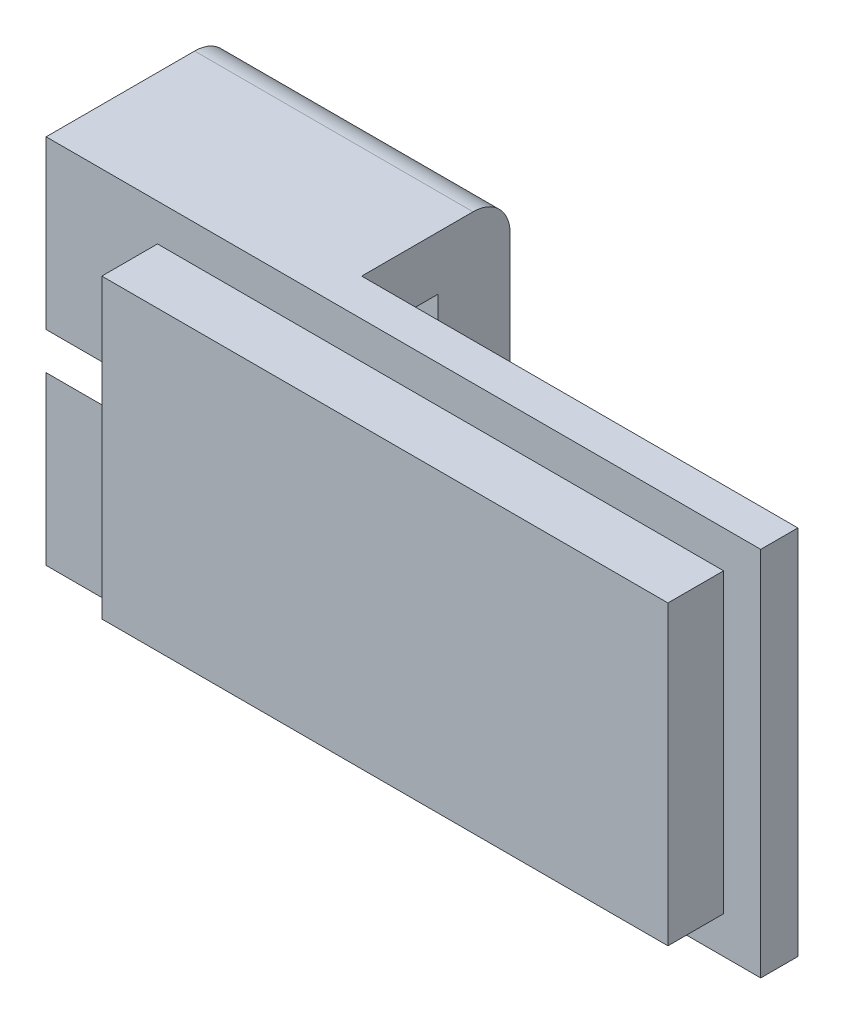
from build123d import *

# Parameters (mm, degrees)
SKETCH1_W           = 20
SKETCH1_H           = 10
BOSS_EXTRUDE1_DEPTH = 38.5
SKETCH5_W           = 16
SKETCH5_H           = 30.5
BOSS_EXTRUDE2_DEPTH = 8
SKETCH2_R           = 5.1
CUT_EXTRUDE3_DEPTH  = 10
FILLET1_R           = 2
SKETCH6_W           = 23.5
SKETCH6_H           = 20
CUT_EXTRUDE4_DEPTH  = 8
SKETCH7_W           = 2.2
SKETCH7_H           = 2.2
CUT_EXTRUDE5_DEPTH  = 3


with BuildPart() as part:
    # Sketch1 → Boss-Extrude1 (new body)
    with BuildSketch(Plane.YZ):
        Rectangle(SKETCH1_W, SKETCH1_H)
    extrude(amount=BOSS_EXTRUDE1_DEPTH)

    # Sketch5 → Boss-Extrude2 (add)
    with BuildSketch(Plane(origin=(0, 0, 0), x_dir=(0, 1, 0), z_dir=(0, 0, 1))):
        with Locations((0, -21.25)):
            Rectangle(SKETCH5_W, SKETCH5_H)
    extrude(amount=BOSS_EXTRUDE2_DEPTH)

    # Sketch2 → Cut-Extrude3 (cut)
    with BuildSketch(Plane.YZ):
        Circle(SKETCH2_R)
    extrude(amount=CUT_EXTRUDE3_DEPTH, mode=Mode.SUBTRACT)

    # Fillet1
    fillet1_edges = [part.edges().sort_by_distance(p)[0] for p in [
        (19.25, 10, -5),
        (19.25, -10, -5),
    ]]
    fillet(fillet1_edges, radius=FILLET1_R)

    # Sketch6 → Cut-Extrude4 (cut)
    with BuildSketch(Plane(origin=(0, 0, -5), x_dir=(1, 0, 0), z_dir=(0, 0, -1))):
        with Locations((26.75, 0)):
            Rectangle(SKETCH6_W, SKETCH6_H)
    extrude(amount=-CUT_EXTRUDE4_DEPTH, mode=Mode.SUBTRACT)

    # Sketch7 → Cut-Extrude5 (cut)
    with BuildSketch(Plane.YZ.offset(15)):
        with Locations((6, 0)):
            Rectangle(SKETCH7_W, SKETCH7_H)
        with Locations((-6, 0)):
            Rectangle(SKETCH7_W, SKETCH7_H)
    extrude(amount=-CUT_EXTRUDE5_DEPTH, mode=Mode.SUBTRACT)


solid = part.part
